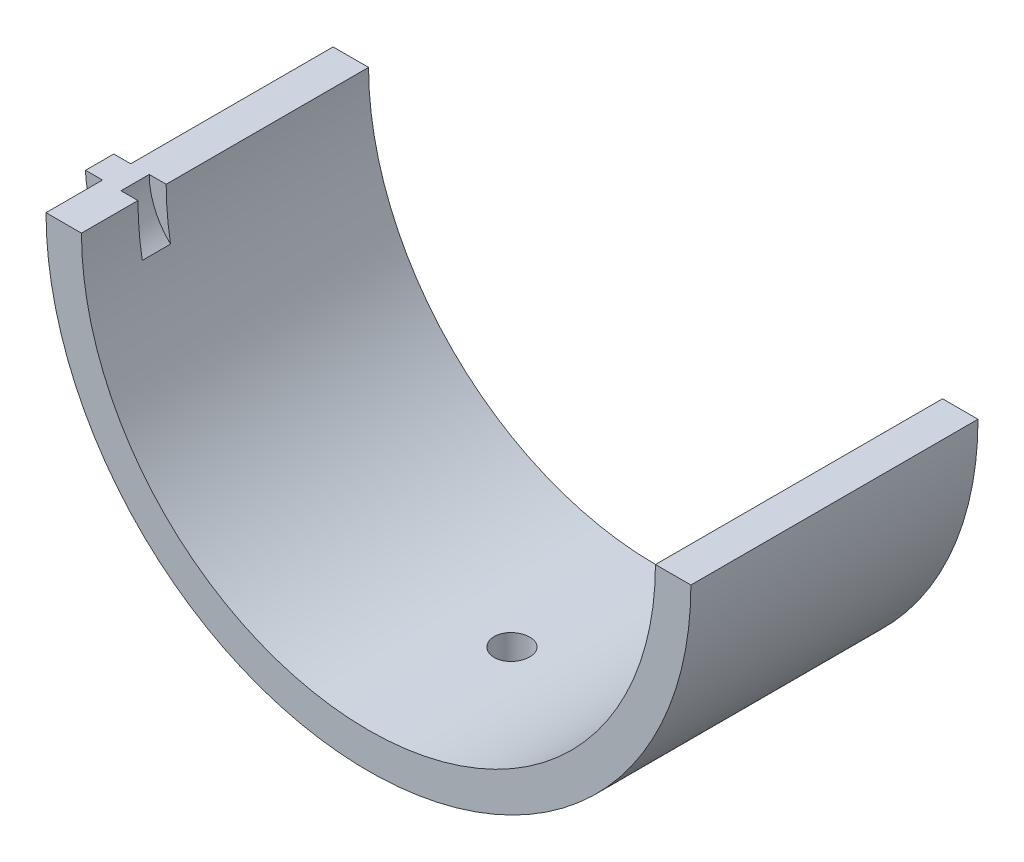
from build123d import *

# Parameters (mm, degrees)
BOSS_EXTRUDE1_DEPTH     = 32.2834
CUT_EXTRUDE1_REACH      = 62.594
CUT_EXTRUDE1_END_RADIUS = 32.2707
SKETCH2_R               = 1.9939
BOSS_EXTRUDE2_DEPTH     = 3.175
CUT_EXTRUDE2_DEPTH      = 3.175


with BuildPart() as part:
    # Sketch1 → Boss-Extrude1 (new body)
    with BuildSketch(Plane.XY):
        with BuildLine():
            Line((-36.2585, 36.2585), (-32.2707, 36.2585))
            ThreePointArc((-32.2707, 36.2585), (0, 3.9878), (32.2707, 36.2585))
            Line((32.2707, 36.2585), (36.2585, 36.2585))
            ThreePointArc((36.2585, 36.2585), (0, 0), (-36.2585, 36.2585))
        make_face()
    extrude(amount=-BOSS_EXTRUDE1_DEPTH)

    # Cut-Extrude1: up to this cylinder (the profile starts outside it)
    cut_extrude1_end = Plane(origin=(0, 36.2585, -16.1417), z_dir=(0, 0, 1)) * Cylinder(CUT_EXTRUDE1_END_RADIUS, 190.7294, mode=Mode.PRIVATE)
    # Sketch2 → Cut-Extrude1 (cut, up to the surface)
    with BuildSketch(Plane(origin=(0, 0, 0), x_dir=(1, 0, 0), z_dir=(0, 1, 0)), mode=Mode.PRIVATE) as cut_extrude1_sk1:
        with Locations(Location((0, 16.1417, 0), (0, 0, 90))):
            Circle(SKETCH2_R)
    cut_extrude1_tool1 = extrude(cut_extrude1_sk1.sketch, amount=CUT_EXTRUDE1_REACH, mode=Mode.PRIVATE) - cut_extrude1_end
    add(cut_extrude1_tool1.solids().sort_by_distance((0, 0, -16.1417))[0], mode=Mode.SUBTRACT)

    # Sketch4 → Boss-Extrude2 (add)
    with BuildSketch(Plane.XY.offset(-6.35)):
        with BuildLine():
            Line((-36.2585, 36.2585), (-38.1635, 36.2585))
            ThreePointArc((-38.1635, 36.2585), (-37.555411186, 33.230080338), (-35.825412395, 30.671134883))
            ThreePointArc((-35.825412395, 30.671134883), (-36.150065958, 33.456437642), (-36.2585, 36.2585))
        make_face()
    extrude(amount=-BOSS_EXTRUDE2_DEPTH)

    # Sketch5 → Cut-Extrude2 (cut)
    with BuildSketch(Plane.XY.offset(-6.35)):
        with BuildLine():
            Line((-32.2707, 36.2585), (-34.1757, 36.2585))
            ThreePointArc((-34.1757, 36.2585), (-33.552449463, 33.219498064), (-31.783319989, 30.671134883))
            ThreePointArc((-31.783319989, 30.671134883), (-32.148624099, 33.454209171), (-32.2707, 36.2585))
        make_face()
    extrude(amount=-CUT_EXTRUDE2_DEPTH, mode=Mode.SUBTRACT)


solid = part.part
